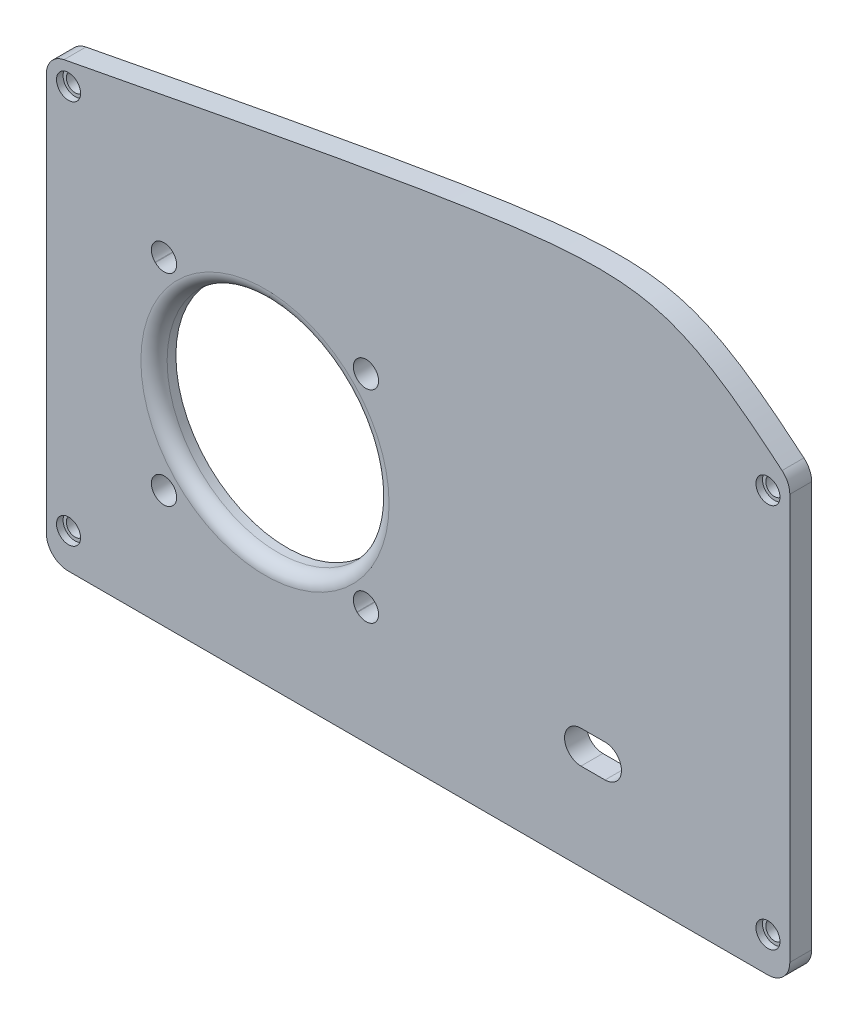
from build123d import *

# Parameters (mm, degrees)
BOSS_EXTRU_1_DEPTH           = 5
ESQUISSE3_R                  = 2
ENL_V_MAT_EXTRU_1_DEPTH      = 5
ESQUISSE4_R                  = 2.75
ENL_V_MAT_EXTRU_2_DEPTH      = 1.5
ENL_V_MAT_EXTRU_3_DEPTH      = 5
ENL_V_MAT_EXTRU_3_DEPTH_BACK = 12.5
ESQUISSE5_R                  = 25.375
CONG_1_R                     = 3
CONG_2_R                     = 5
ENL_V_MAT_EXTRU_4_DEPTH      = 10
ENL_V_MAT_EXTRU_5_DEPTH      = 10


with BuildPart() as part:
    # Esquisse2 → Boss.-Extru.1 (new body)
    with BuildSketch(Plane.XY):
        with BuildLine():
            Line((-23.222436044, 101.309927053), (-23.222436044, 1.309999322))
            Line((-23.222436044, 1.309999322), (146.777563956, 1.309999322))
            Line((146.777563956, 1.309999322), (146.777563956, 101.30967935))
            add(Edge.make_bspline(
                [(146.777563956, 101.30967935), (145.378292327, 102.508699243), (143.969584716, 103.696244388), (141.124926397, 106.038205363), (139.688572163, 107.193033092), (136.777525095, 109.452247335), (135.305624265, 110.554710529), (132.312941473, 112.678620745), (130.792251165, 113.700219676), (127.677430057, 115.621696386), (126.083009921, 116.521094618), (123.612517857, 117.739485375), (122.775823394, 118.123742581), (121.071813997, 118.841506261), (120.201311014, 119.175853835), (117.565229929, 120.085558525), (115.777516182, 120.566804891), (112.144518509, 121.29157916), (110.293283793, 121.537221637), (106.597133423, 121.840020183), (104.747512209, 121.900433532), (101.046171299, 121.897761869), (99.194452085, 121.834705231), (95.489628441, 121.627070014), (93.63921765, 121.482100865), (89.947842728, 121.138535108), (88.105538062, 120.939709848), (82.585629662, 120.287230662), (78.914789341, 119.779509377), (71.58218577, 118.691503857), (67.920223281, 118.109593605), (56.945952512, 116.3014836), (49.644200811, 115.014768518), (35.051716985, 112.379241478), (27.761400742, 111.027882072), (5.899236405, 106.92561859), (-8.663476314, 104.127599978), (-23.222436044, 101.309927053)],
                knots=[0, 0, 0, 0, 0.03125, 0.03125, 0.0625, 0.0625, 0.09375, 0.09375, 0.125, 0.125, 0.15625, 0.15625, 0.171875, 0.171875, 0.1875, 0.1875, 0.21875, 0.21875, 0.25, 0.25, 0.28125, 0.28125, 0.3125, 0.3125, 0.34375, 0.34375, 0.375, 0.375, 0.4375, 0.4375, 0.5, 0.5, 0.625, 0.625, 0.75, 0.75, 1, 1, 1, 1], degree=3))
        make_face()
    extrude(amount=BOSS_EXTRU_1_DEPTH)

    # Esquisse3 → Enlèv. mat.-Extru.1 (cut)
    with BuildSketch(Plane.XY.offset(5)):
        with Locations((-18.142436044, 97.29218842)):
            Circle(ESQUISSE3_R)
        with Locations(Location((-18.142436044, 9.309999322, 0), (0, 0, 180))):
            Circle(ESQUISSE3_R)
        with Locations((141.777563956, 9.309999322)):
            Circle(ESQUISSE3_R)
        with Locations(Location((141.777563956, 97.29218842, 0), (0, 0, 180))):
            Circle(ESQUISSE3_R)
    extrude(amount=-ENL_V_MAT_EXTRU_1_DEPTH, mode=Mode.SUBTRACT)

    # Esquisse4 → Enlèv. mat.-Extru.2 (cut)
    with BuildSketch(Plane.XY.offset(5)):
        with Locations((-18.142436044, 97.29218842)):
            Circle(ESQUISSE4_R)
        with Locations((141.777563956, 97.29218842)):
            Circle(ESQUISSE4_R)
        with Locations((-18.142436044, 9.309999322)):
            Circle(ESQUISSE4_R)
        with Locations((141.777563956, 9.309999322)):
            Circle(ESQUISSE4_R)
    extrude(amount=-ENL_V_MAT_EXTRU_2_DEPTH, mode=Mode.SUBTRACT)

    # Esquisse5 → Enlèv. mat.-Extru.3 (cut, two sides: drawn at the far end of the back side and taken through both)
    with BuildSketch(Plane.XY.offset(5).offset(-ENL_V_MAT_EXTRU_3_DEPTH_BACK)):
        with Locations(Location((26.777563956, 51.309999322, 0), (0, 0, 180))):
            Circle(ESQUISSE5_R)
    extrude(amount=ENL_V_MAT_EXTRU_3_DEPTH + ENL_V_MAT_EXTRU_3_DEPTH_BACK, mode=Mode.SUBTRACT)

    # Congé1
    cong_1_edges = [part.edges().sort_by_distance(p)[0] for p in [
        (52.152563956, 51.309999322, 5),
    ]]
    fillet(cong_1_edges, radius=CONG_1_R)

    # Congé2
    cong_2_edges = [part.edges().sort_by_distance(p)[0] for p in [
        (146.777563956, 101.30967935, 2.5),
        (146.777563956, 1.309999322, 2.5),
        (-23.222436044, 1.309999322, 2.5),
        (-23.222436044, 101.309927053, 2.5),
    ]]
    fillet(cong_2_edges, radius=CONG_2_R)

    # Esquisse6 → Enlèv. mat.-Extru.4 (cut)
    with BuildSketch(Plane.XY.offset(5)):
        with BuildLine():
            Line((5.741137215, 76.376934715), (5.670426537, 76.447645393))
            ThreePointArc((5.670426537, 76.447645393), (1.639917885, 76.447645393), (1.639917885, 72.41713674))
            Line((1.639917885, 72.41713674), (1.710628563, 72.346426062))
            ThreePointArc((1.710628563, 72.346426062), (5.741137215, 72.346426062), (5.741137215, 76.376934715))
        make_face()
        with BuildLine():
            Line((47.813990696, 76.376934715), (47.884701374, 76.447645393))
            ThreePointArc((47.884701374, 76.447645393), (51.915210027, 76.447645393), (51.915210027, 72.41713674))
            Line((51.915210027, 72.41713674), (51.844499349, 72.346426062))
            ThreePointArc((51.844499349, 72.346426062), (47.813990696, 72.346426062), (47.813990696, 76.376934715))
        make_face()
        with BuildLine():
            Line((47.813990696, 26.243063929), (47.884701374, 26.172353251))
            ThreePointArc((47.884701374, 26.172353251), (51.915210027, 26.172353251), (51.915210027, 30.202861903))
            Line((51.915210027, 30.202861903), (51.844499349, 30.273572582))
            ThreePointArc((51.844499349, 30.273572582), (47.813990696, 30.273572582), (47.813990696, 26.243063929))
        make_face()
        with BuildLine():
            Line((5.741137215, 26.243063929), (5.670426537, 26.172353251))
            ThreePointArc((5.670426537, 26.172353251), (1.639917885, 26.172353251), (1.639917885, 30.202861903))
            Line((1.639917885, 30.202861903), (1.710628563, 30.273572582))
            ThreePointArc((1.710628563, 30.273572582), (5.741137215, 30.273572582), (5.741137215, 26.243063929))
        make_face()
    extrude(amount=-ENL_V_MAT_EXTRU_4_DEPTH, mode=Mode.SUBTRACT)

    # Esquisse7 → Enlèv. mat.-Extru.5 (cut)
    with BuildSketch(Plane.XY.offset(5)):
        with BuildLine():
            Line((99.027563956, 28.809999322), (104.527563956, 28.809999322))
            ThreePointArc((104.527563956, 28.809999322), (108.277563956, 25.059999322), (104.527563956, 21.309999322))
            Line((104.527563956, 21.309999322), (99.027563956, 21.309999322))
            ThreePointArc((99.027563956, 21.309999322), (95.277563956, 25.059999322), (99.027563956, 28.809999322))
        make_face()
    extrude(amount=-ENL_V_MAT_EXTRU_5_DEPTH, mode=Mode.SUBTRACT)


solid = part.part
